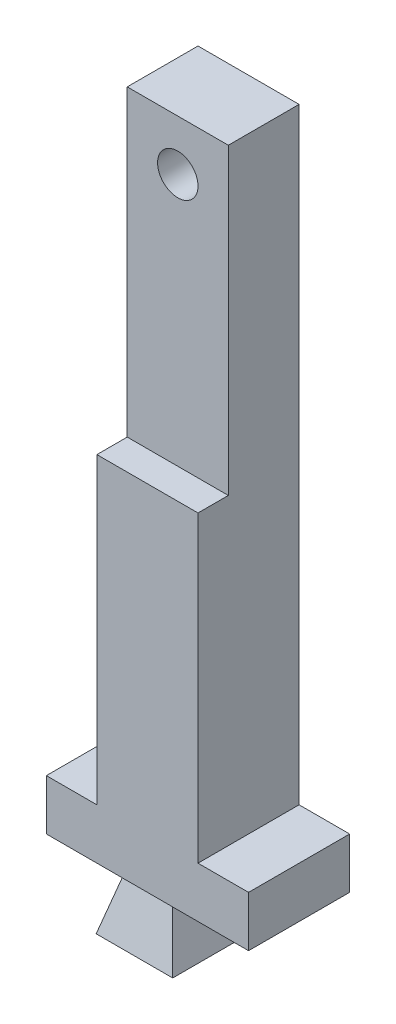
from build123d import *

# Parameters (mm, degrees)
BOSS_EXTRUDE2_DEPTH = 12.7
SKETCH2_W           = 12.7
SKETCH2_H           = 6.35
BOSS_EXTRUDE3_DEPTH = 38.1
SKETCH3_W           = 6.35
SKETCH3_H           = 12.7
BOSS_EXTRUDE5_DEPTH = 6.096
BOSS_EXTRUDE5_DRAFT = -15
SKETCH4_W           = 12.7
SKETCH4_H           = 38.1
BOSS_EXTRUDE6_DEPTH = 2.54
SKETCH5_R           = 2.54
CUT_EXTRUDE1_DEPTH  = 8.89


with BuildPart() as part:
    # Sketch1 → Boss-Extrude2 (new body)
    with BuildSketch(Plane.XY):
        Polygon((12.7, 0), (19.05, 0), (19.05, 6.35), (12.7, 6.35), (12.7, 44.45), (0, 44.45), (0, 6.35), (-6.35, 6.35), (-6.35, 0), (0, 0), align=None)
    extrude(amount=BOSS_EXTRUDE2_DEPTH)

    # Sketch2 → Boss-Extrude3 (add)
    with BuildSketch(Plane(origin=(0, 44.45, 0), x_dir=(1, 0, 0), z_dir=(0, 1, 0))):
        with Locations((6.35, -3.175)):
            Rectangle(SKETCH2_W, SKETCH2_H)
    extrude(amount=BOSS_EXTRUDE3_DEPTH)


with BuildPart() as boss_extrude5_tool:
    # Sketch3 → Boss-Extrude5 (with draft: the straight prism first)
    with BuildSketch(Plane.XZ):
        with Locations((6.35, 6.35)):
            Rectangle(SKETCH3_W, SKETCH3_H)
    extrude(amount=BOSS_EXTRUDE5_DEPTH)
    # Boss-Extrude5: the draft: its side faces are tilted about the plane it starts from
    boss_extrude5_sides = [boss_extrude5_tool.faces().sort_by_distance(p)[0] for p in [
        (6.35, -3.048, 0),
        (9.525, -3.048, 6.35),
        (6.35, -3.048, 12.7),
        (3.175, -3.048, 6.35),
    ]]
    draft(boss_extrude5_sides, Plane.XZ, BOSS_EXTRUDE5_DRAFT)


with BuildPart() as part_1:
    add(part.part)

    # Boss-Extrude5: add boss_extrude5_tool
    add(boss_extrude5_tool.part)

    # Sketch4 → Boss-Extrude6 (add)
    with BuildSketch(Plane.XY.offset(6.35)):
        with Locations((6.35, 63.5)):
            Rectangle(SKETCH4_W, SKETCH4_H)
    extrude(amount=BOSS_EXTRUDE6_DEPTH)

    # Sketch5 → Cut-Extrude1 (cut)
    with BuildSketch(Plane.XY.offset(8.89)):
        with Locations((6.35, 76.2)):
            Circle(SKETCH5_R)
    extrude(amount=-CUT_EXTRUDE1_DEPTH, mode=Mode.SUBTRACT)


solid = part_1.part
